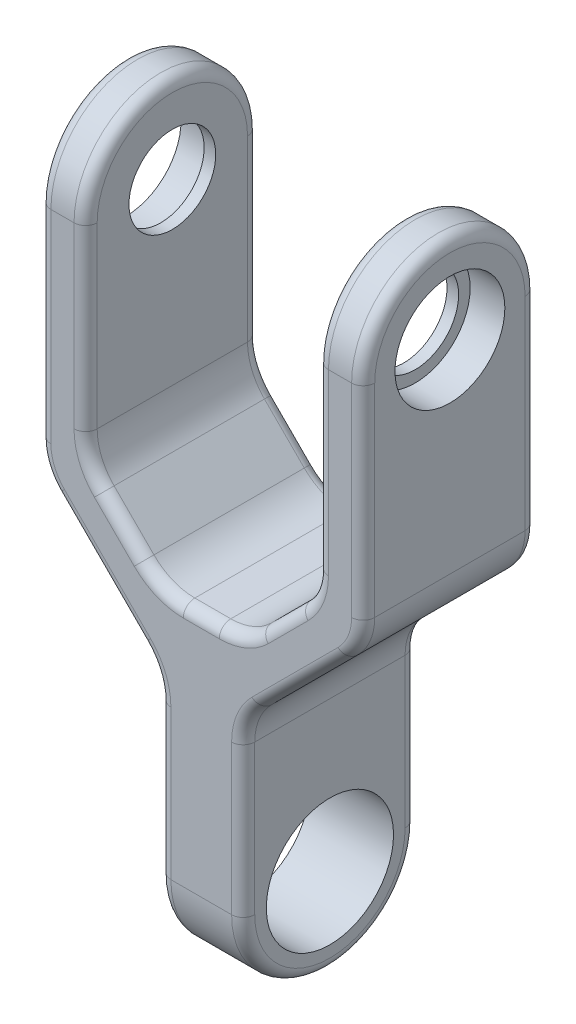
from build123d import *

# Parameters (mm, degrees)
EXTRUDE_1_DEPTH     = 30
CUT_EXTRUDE_1_DEPTH = 102.205545797
EXTRUDE_2_DEPTH     = 14.5
SKETCH_4_R          = 11
CUT_EXTRUDE_2_DEPTH = 20
EXTRUDE_3_DEPTH     = 8
EXTRUDE_START       = -8
EXTRUDE_4_DEPTH     = 8
SKETCH_9_R          = 7.5
CUT_EXTRUDE_5_DEPTH = 62
SKETCH_10_R         = 9.5
CUT_EXTRUDE_6_DEPTH = 6
CUT_EXTRUDE_START   = -6
SKETCH_11_R         = 9.5
CUT_EXTRUDE_7_DEPTH = 6
FILLET_1_R          = 10
FILLET_2_R          = 2


with BuildPart() as part:
    # 草图1 → 凸台-拉伸1 (new body)
    with BuildSketch(Plane.XY):
        Polygon((0, 0), (14.5, 0), (14.5, 30), (35.25, 50.75), (35.25, 90), (27.25, 90), (27.25, 55), (-12.75, 55), (-12.75, 90), (-20.75, 90), (-20.75, 50.75), (0, 30), align=None)
    extrude(amount=EXTRUDE_1_DEPTH)

    # 草图2 → 切除-拉伸1 (cut, through all)
    with BuildSketch(Plane.XY.offset(30)):
        Polygon((-12.75, 55), (0, 42.25), (14.5, 42.25), (27.25, 55), align=None)
    extrude(amount=-CUT_EXTRUDE_1_DEPTH, mode=Mode.SUBTRACT)

    # 草图3 → 凸台-拉伸2 (add)
    with BuildSketch(Plane(origin=(14.5, 0, 0), x_dir=(0, 0, -1), z_dir=(1, 0, 0))):
        with BuildLine():
            Line((-30, 0), (0, 0))
            ThreePointArc((0, 0), (-15, -15), (-30, 0))
        make_face()
    extrude(amount=-EXTRUDE_2_DEPTH)

    # 草图4 → 切除-拉伸2 (cut)
    with BuildSketch(Plane(origin=(14.5, 0, 0), x_dir=(0, 0, -1), z_dir=(1, 0, 0))):
        with Locations((-15, 0)):
            Circle(SKETCH_4_R)
    extrude(amount=-CUT_EXTRUDE_2_DEPTH, mode=Mode.SUBTRACT)

    # 草图7 → 凸台-拉伸3 (add)
    with BuildSketch(Plane(origin=(35.25, 0, 0), x_dir=(0, 0, -1), z_dir=(1, 0, 0))):
        with BuildLine():
            Line((-30, 90), (0, 90))
            ThreePointArc((0, 90), (-15, 105), (-30, 90))
        make_face()
    extrude(amount=-EXTRUDE_3_DEPTH)

    # 草图8 → 凸台-拉伸4 (add)
    with BuildSketch(Plane.ZY.offset(20.75).offset(EXTRUDE_START)):
        with BuildLine():
            Line((0, 90), (30, 90))
            ThreePointArc((30, 90), (15, 105), (0, 90))
        make_face()
    extrude(amount=EXTRUDE_4_DEPTH)

    # 草图9 → 切除-拉伸5 (cut)
    with BuildSketch(Plane.ZY.offset(20.75)):
        with Locations(Location((15, 90, 0), (0, 0, 270))):
            Circle(SKETCH_9_R)
    extrude(amount=-CUT_EXTRUDE_5_DEPTH, mode=Mode.SUBTRACT)

    # 草图10 → 切除-拉伸6 (cut)
    with BuildSketch(Plane.ZY.offset(20.75)):
        with Locations(Location((15, 90, 0), (0, 0, 270))):
            Circle(SKETCH_10_R)
    extrude(amount=-CUT_EXTRUDE_6_DEPTH, mode=Mode.SUBTRACT)

    # 草图11 → 切除-拉伸7 (cut)
    with BuildSketch(Plane(origin=(35.25, 0, 0), x_dir=(0, 0, -1), z_dir=(1, 0, 0)).offset(CUT_EXTRUDE_START)):
        with Locations(Location((-15, 90, 0), (0, 0, 270))):
            Circle(SKETCH_11_R)
    extrude(amount=CUT_EXTRUDE_7_DEPTH, mode=Mode.SUBTRACT)

    # 圆角1
    fillet_1_edges = [part.edges().sort_by_distance(p)[0] for p in [
        (0, 30, 15),
        (-20.75, 50.75, 15),
        (-12.75, 55, 15),
        (27.25, 55, 15),
        (35.25, 50.75, 15),
        (14.5, 30, 15),
        (14.5, 42.25, 15),
        (0, 42.25, 15),
    ]]
    fillet(fillet_1_edges, radius=FILLET_1_R)

    # 圆角2
    fillet_2_edges = [part.edges().sort_by_distance(p)[0] for p in [
        (20.875, 48.625, 30),
        (20.875, 48.625, 0),
        (7.25, 42.25, 30),
        (7.25, 42.25, 0),
        (-6.375, 48.625, 30),
        (-6.375, 48.625, 0),
        (-12.75, 74.571067812, 0),
        (-12.75, 74.571067812, 30),
        (-10.375, 40.375, 0),
        (-10.375, 40.375, 30),
        (35.25, 72.446067812, 0),
        (24.875, 40.375, 0),
        (0, 12.928932188, 0),
        (34.488795325, 51.0653013, 0),
        (-19.988795325, 51.0653013, 0),
        (0, 12.928932188, 30),
        (24.875, 40.375, 30),
        (35.25, 72.446067812, 30),
        (34.488795325, 51.0653013, 30),
        (-19.988795325, 51.0653013, 30),
        (-20.75, 72.446067812, 0),
        (26.488795325, 55.3153013, 0),
        (26.488795325, 55.3153013, 30),
        (14.1846987, 43.011204675, 30),
        (14.1846987, 43.011204675, 0),
        (0.3153013, 43.011204675, 30),
        (0.3153013, 43.011204675, 0),
        (14.5, 12.928932188, 30),
        (-11.988795325, 55.3153013, 0),
        (-11.988795325, 55.3153013, 30),
        (-0.761204675, 29.6846987, 0),
        (-0.761204675, 29.6846987, 30),
        (15.261204675, 29.6846987, 0),
        (15.261204675, 29.6846987, 30),
        (27.25, 74.571067812, 0),
        (14.5, 12.928932188, 0),
        (27.25, 74.571067812, 30),
        (-20.75, 72.446067812, 30),
        (14.5, -15, 15),
        (0, -15, 15),
        (35.25, 105, 15),
        (27.25, 105, 15),
        (-20.75, 105, 15),
        (-12.75, 105, 15),
    ]]
    fillet(fillet_2_edges, radius=FILLET_2_R)


solid = part.part
